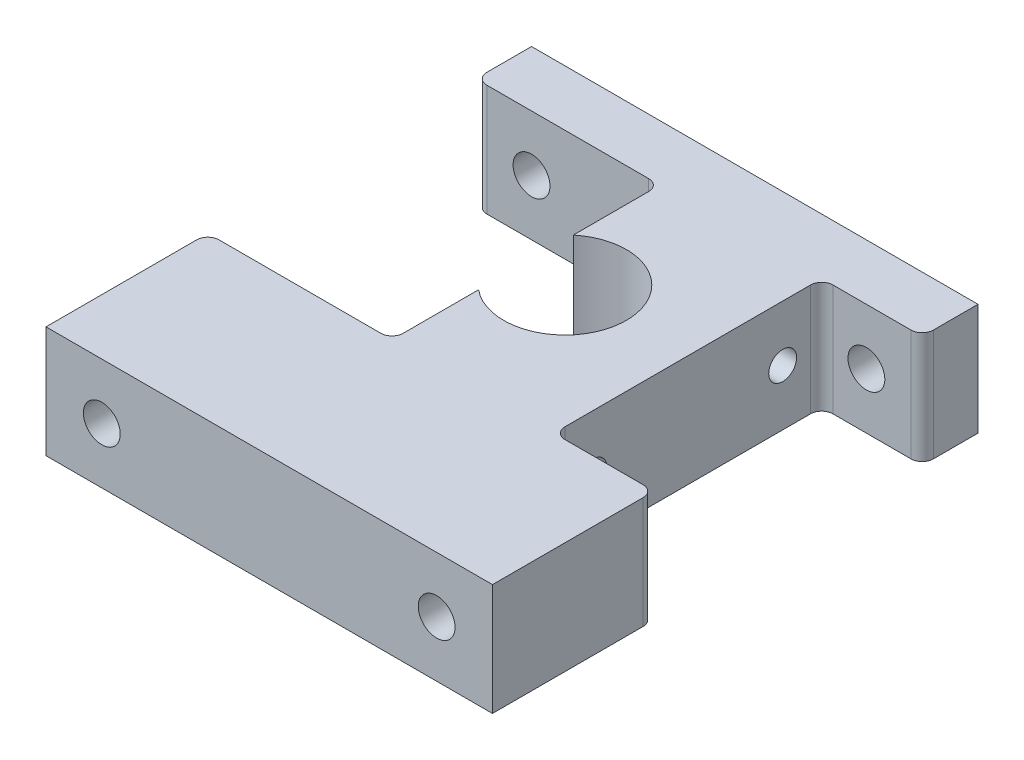
from build123d import *

# Parameters (mm, degrees)
SKETCH_1_W             = 40
SKETCH_1_H             = 34
SKETCH_1_R             = 5.5
EXTRUDE_1_DEPTH        = 10
CUT_EXTRUDE_2_DEPTH    = 29.08914381
FILLET_1_R             = 1
HOLE_WIZARD_M3_1_D     = 2.5
SKETCH_13_W            = 40
SKETCH_13_H            = 9.5
EXTRUDE_2_DEPTH        = 10
HOLE_WIZARD_M4_1_D     = 3.3
HOLE_WIZARD_M4_1_DEPTH = 14.5
HOLE_WIZARD_M4_3_D     = 3.3


with BuildPart() as part:
    # 草图1 → 凸台-拉伸1 (new body)
    with BuildSketch(Plane(origin=(0, 0, 0), x_dir=(1, 0, 0), z_dir=(0, 1, 0))):
        Rectangle(SKETCH_1_W, SKETCH_1_H)
        with Locations(Location((0, 0, 0), (0, 0, 270))):
            Circle(SKETCH_1_R, mode=Mode.SUBTRACT)
    extrude(amount=EXTRUDE_1_DEPTH)

    # 草图3 → 切除-拉伸2 (cut, through all)
    with BuildSketch(Plane.XZ):
        with BuildLine():
            Line((-36.5, -12), (-4.5, -12))
            ThreePointArc((-4.5, -12), (-3.792893219, -11.707106781), (-3.5, -11))
            Line((-3.5, -11), (-3.5, 11))
            ThreePointArc((-3.5, 11), (-3.792893219, 11.707106781), (-4.5, 12))
            Line((-4.5, 12), (-36.5, 12))
            Line((-36.5, 12), (-36.5, -12))
        make_face()
        with BuildLine():
            Line((12, -12), (29, -12))
            Line((29, -12), (29, 12))
            Line((29, 12), (12, 12))
            ThreePointArc((12, 12), (11.292893219, 11.707106781), (11, 11))
            Line((11, 11), (11, -11))
            ThreePointArc((11, -11), (11.292893219, -11.707106781), (12, -12))
        make_face()
    extrude(amount=-CUT_EXTRUDE_2_DEPTH, mode=Mode.SUBTRACT)

    # 圆角1
    fillet_1_edges = [part.edges().sort_by_distance(p)[0] for p in [
        (-20, 5, -12),
        (-20, 5, 12),
        (20, 5, 12),
        (20, 5, -12),
    ]]
    fillet(fillet_1_edges, radius=FILLET_1_R)

    # M3 螺纹孔1 (through all)
    with Locations(Plane.ZY.offset(3.5)):
        with Locations((-8.5, 5), (8.5, 5)):
            Hole(HOLE_WIZARD_M3_1_D / 2)

    # 草图13 → 凸台-拉伸2 (add)
    with BuildSketch(Plane(origin=(0, 0, 0), x_dir=(-1, 0, 0), z_dir=(0, -1, 0))):
        with Locations((0, -21.75)):
            Rectangle(SKETCH_13_W, SKETCH_13_H)
    extrude(amount=-EXTRUDE_2_DEPTH)

    # M4 螺纹孔1
    with Locations(Plane.XY.offset(26.5)):
        with Locations((-15, 5), (15, 5)):
            Hole(HOLE_WIZARD_M4_1_D / 2, depth=HOLE_WIZARD_M4_1_DEPTH)

    # M4 螺纹孔3 (through all)
    with Locations(Plane(origin=(15, 5, -17), x_dir=(-1, 0, 0), z_dir=(0, 0, -1))):
        with Locations((0, 0), (30, 0)):
            Hole(HOLE_WIZARD_M4_3_D / 2)


solid = part.part
